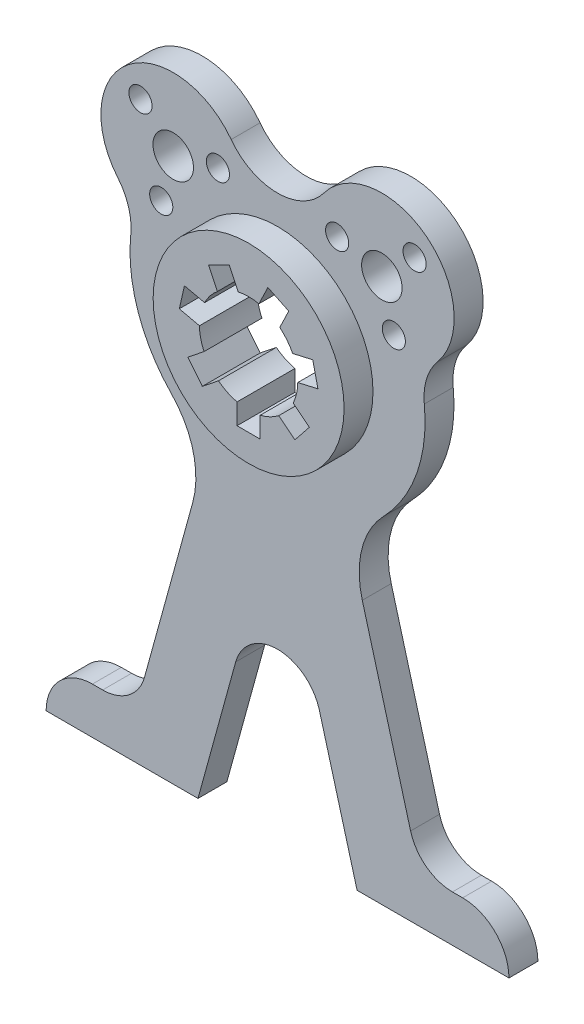
from build123d import *

# Parameters (mm, degrees)
SKETCH_1_R      = 4
SKETCH_1_R_2    = 7
SKETCH_1_R_3    = 33
EXTRUDE_1_DEPTH = 10
SKETCH_1_3_R    = 33
EXTRUDE_2_DEPTH = 20


with BuildPart() as part:
    # Эскиз1 → Бобышка-Вытянуть1 (new body)
    with BuildSketch(Plane.XY):
        with BuildLine():
            ThreePointArc((-64, -136), (-75.313708499, -140.686291501), (-80, -152))
            Line((-80, -152), (-27.5, -152))
            Line((-27.5, -152), (-14.463080892, -104.593021426))
            ThreePointArc((-14.463080892, -104.593021426), (0, -93.570368671), (14.463080892, -104.593021426))
            Line((14.463080892, -104.593021426), (27.5, -152))
            Line((27.5, -152), (80, -152))
            ThreePointArc((80, -152), (75.313708499, -140.686291501), (64, -136))
            Line((64, -136), (60.459937025, -136))
            ThreePointArc((60.459937025, -136), (51.367638325, -132.930218118), (45.996856133, -124.977347245))
            Line((45.996856133, -124.977347245), (29.300488581, -64.26328342))
            ThreePointArc((29.300488581, -64.26328342), (29.160343249, -48.882298429), (36.661224304, -35.453555993))
            ThreePointArc((36.661224304, -35.453555993), (48.195333852, -16.679622146), (50.733420691, 5.207689026))
            ThreePointArc((50.733420691, 5.207689026), (51.500326923, 13.089309145), (55.266020254, 20.05548705))
            ThreePointArc((55.266020254, 20.05548705), (51.548317959, 55.688646816), (16.027753707, 51.016077878))
            ThreePointArc((16.027753707, 51.016077878), (0, 42.978983508), (-16.027753707, 51.016077878))
            ThreePointArc((-16.027753707, 51.016077878), (-51.548317959, 55.688646816), (-55.266020254, 20.05548705))
            ThreePointArc((-55.266020254, 20.05548705), (-51.500326923, 13.089309145), (-50.733420691, 5.207689026))
            ThreePointArc((-50.733420691, 5.207689026), (-48.195333852, -16.679622146), (-36.661224304, -35.453555993))
            ThreePointArc((-36.661224304, -35.453555993), (-29.160343249, -48.882298429), (-29.300488581, -64.26328342))
            Line((-29.300488581, -64.26328342), (-45.996856133, -124.977347245))
            ThreePointArc((-45.996856133, -124.977347245), (-51.367638325, -132.930218118), (-60.459937025, -136))
            Line((-60.459937025, -136), (-64, -136))
        make_face()
        with Locations((-40.203550562, 20.60763262)):
            Circle(SKETCH_1_R, mode=Mode.SUBTRACT)
        with Locations((-47.376154339, 47.376154339)):
            Circle(SKETCH_1_R, mode=Mode.SUBTRACT)
        with Locations((-36.062445841, 36.062445841)):
            Circle(SKETCH_1_R_2, mode=Mode.SUBTRACT)
        with Locations((-20.60763262, 40.203550562)):
            Circle(SKETCH_1_R, mode=Mode.SUBTRACT)
        Circle(SKETCH_1_R_3, mode=Mode.SUBTRACT)
        with Locations((20.60763262, 40.203550562)):
            Circle(SKETCH_1_R, mode=Mode.SUBTRACT)
        with Locations((36.062445841, 36.062445841)):
            Circle(SKETCH_1_R_2, mode=Mode.SUBTRACT)
        with Locations((40.203550562, 20.60763262)):
            Circle(SKETCH_1_R, mode=Mode.SUBTRACT)
        with Locations((47.376154339, 47.376154339)):
            Circle(SKETCH_1_R, mode=Mode.SUBTRACT)
    extrude(amount=EXTRUDE_1_DEPTH)

    # Эскиз1<3> → Бобышка-Вытянуть2 (add)
    with BuildSketch(Plane.XY):
        Circle(SKETCH_1_3_R)
        with BuildLine():
            Line((-4, -23.664319132), (-4, -16.522711642))
            ThreePointArc((-4, -16.522711642), (-7.376023565, -15.316470754), (-10.42401693, -13.429068138))
            Line((-10.42401693, -13.429068138), (-16.007550501, -17.881787577))
            Line((-16.007550501, -17.881787577), (-20.995468916, -11.627135717))
            Line((-20.995468916, -11.627135717), (-15.411935345, -7.174416278))
            ThreePointArc((-15.411935345, -7.174416278), (-16.573774507, -3.782855877), (-16.9985365, -0.223062423))
            Line((-16.9985365, -0.223062423), (-23.961088981, 1.366094746))
            Line((-23.961088981, 1.366094746), (-22.180921509, 9.165518044))
            Line((-22.180921509, 9.165518044), (-15.218369029, 7.576360875))
            ThreePointArc((-15.218369029, 7.576360875), (-13.291135202, 10.599326632), (-10.772811379, 13.150913846))
            Line((-10.772811379, 13.150913846), (-13.87143874, 19.585279862))
            Line((-13.87143874, 19.585279862), (-6.663687797, 23.056349775))
            Line((-6.663687797, 23.056349775), (-3.565060436, 16.621983759))
            ThreePointArc((-3.565060436, 16.621983759), (0, 17), (3.565060436, 16.621983759))
            Line((3.565060436, 16.621983759), (6.663687797, 23.056349775))
            Line((6.663687797, 23.056349775), (13.87143874, 19.585279862))
            Line((13.87143874, 19.585279862), (10.772811379, 13.150913846))
            ThreePointArc((10.772811379, 13.150913846), (13.291135202, 10.599326632), (15.218369029, 7.576360875))
            Line((15.218369029, 7.576360875), (22.180921509, 9.165518044))
            Line((22.180921509, 9.165518044), (23.961088981, 1.366094746))
            Line((23.961088981, 1.366094746), (16.9985365, -0.223062423))
            ThreePointArc((16.9985365, -0.223062423), (16.573774507, -3.782855877), (15.411935345, -7.174416278))
            Line((15.411935345, -7.174416278), (20.995468916, -11.627135717))
            Line((20.995468916, -11.627135717), (16.007550501, -17.881787577))
            Line((16.007550501, -17.881787577), (10.42401693, -13.429068138))
            ThreePointArc((10.42401693, -13.429068138), (7.376023565, -15.316470754), (4, -16.522711642))
            Line((4, -16.522711642), (4, -23.664319132))
            Line((4, -23.664319132), (-4, -23.664319132))
        make_face(mode=Mode.SUBTRACT)
    extrude(amount=EXTRUDE_2_DEPTH)


solid = part.part
